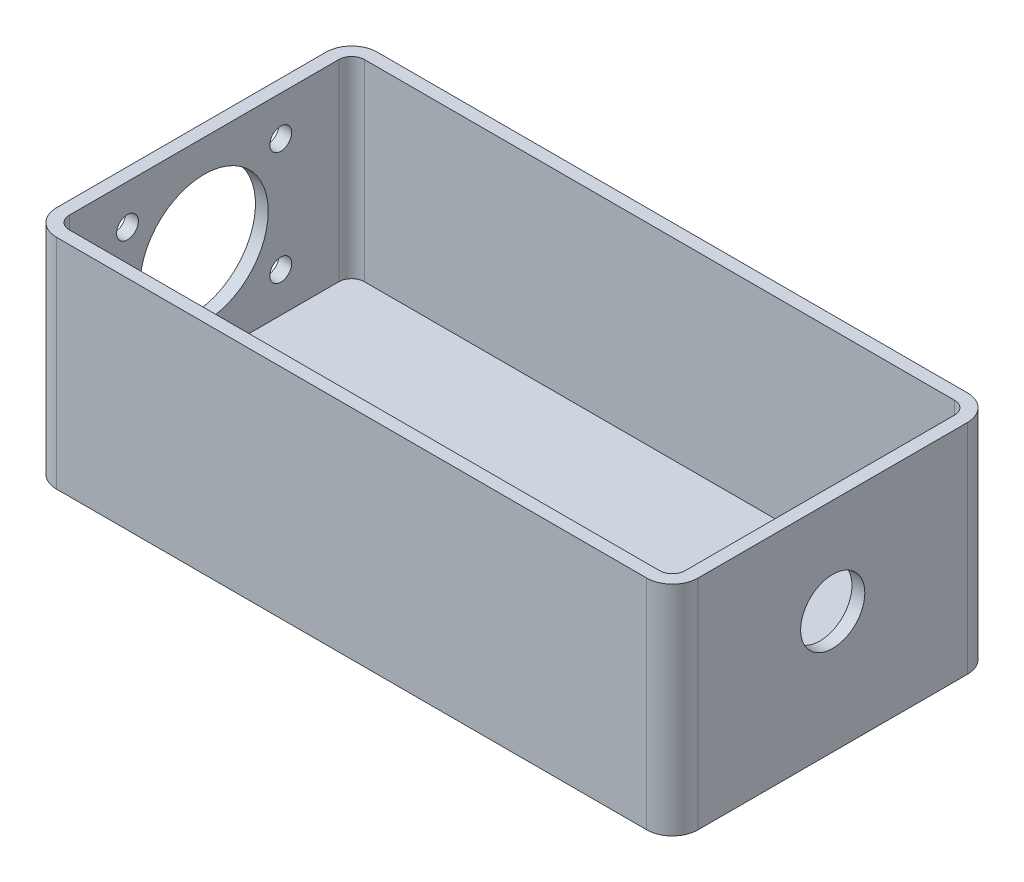
from build123d import *

# Parameters (mm, degrees)
SKETCH1_W           = 127
SKETCH1_H           = 63.5
BOSS_EXTRUDE1_DEPTH = 5.08
SKETCH2_W           = 127
SKETCH2_H           = 63.5
SKETCH2_W_2         = 121.92
SKETCH2_H_2         = 58.42
BOSS_EXTRUDE3_DEPTH = 38.1
CUT_EXTRUDE1_REACH  = 150.411
SKETCH3_R           = 12.7
SKETCH3_R_2         = 2.159
FILLET3_R           = 5.08
FILLET4_R           = 2.54
CUT_EXTRUDE6_REACH  = 150.411
SKETCH4_R           = 6.35


with BuildPart() as part:
    # Sketch1 → Boss-Extrude1 (new body)
    with BuildSketch(Plane(origin=(0, 0, 0), x_dir=(1, 0, 0), z_dir=(0, 1, 0))):
        with Locations((63.5, 31.75)):
            Rectangle(SKETCH1_W, SKETCH1_H)
    extrude(amount=BOSS_EXTRUDE1_DEPTH)

    # Sketch2 → Boss-Extrude3 (add)
    with BuildSketch(Plane(origin=(0, 5.08, 0), x_dir=(1, 0, 0), z_dir=(0, 1, 0))):
        with Locations((63.5, 31.75)):
            Rectangle(SKETCH2_W, SKETCH2_H)
        with Locations((63.5, 31.75)):
            Rectangle(SKETCH2_W_2, SKETCH2_H_2, mode=Mode.SUBTRACT)
    extrude(amount=BOSS_EXTRUDE3_DEPTH)

    # Sketch3 → Cut-Extrude1 (cut, up to next)
    with BuildSketch(Plane.ZY, mode=Mode.PRIVATE) as cut_extrude1_sk1:
        with Locations((-31.75, 24.13)):
            Circle(SKETCH3_R)
    cut_extrude1_tool1 = extrude(cut_extrude1_sk1.sketch, amount=-CUT_EXTRUDE1_REACH, mode=Mode.PRIVATE) & part.part
    # Sketch3 → Cut-Extrude1 (cut, up to next)
    with BuildSketch(Plane.ZY, mode=Mode.PRIVATE) as cut_extrude1_sk2:
        with Locations((-46.9265, 35.3568)):
            Circle(SKETCH3_R_2)
    cut_extrude1_tool2 = extrude(cut_extrude1_sk2.sketch, amount=-CUT_EXTRUDE1_REACH, mode=Mode.PRIVATE) & part.part
    # Sketch3 → Cut-Extrude1 (cut, up to next)
    with BuildSketch(Plane.ZY, mode=Mode.PRIVATE) as cut_extrude1_sk3:
        with Locations((-16.5735, 35.3568)):
            Circle(SKETCH3_R_2)
    cut_extrude1_tool3 = extrude(cut_extrude1_sk3.sketch, amount=-CUT_EXTRUDE1_REACH, mode=Mode.PRIVATE) & part.part
    # Sketch3 → Cut-Extrude1 (cut, up to next)
    with BuildSketch(Plane.ZY, mode=Mode.PRIVATE) as cut_extrude1_sk4:
        with Locations((-46.9265, 12.9032)):
            Circle(SKETCH3_R_2)
    cut_extrude1_tool4 = extrude(cut_extrude1_sk4.sketch, amount=-CUT_EXTRUDE1_REACH, mode=Mode.PRIVATE) & part.part
    # Sketch3 → Cut-Extrude1 (cut, up to next)
    with BuildSketch(Plane.ZY, mode=Mode.PRIVATE) as cut_extrude1_sk5:
        with Locations((-16.5735, 12.9032)):
            Circle(SKETCH3_R_2)
    cut_extrude1_tool5 = extrude(cut_extrude1_sk5.sketch, amount=-CUT_EXTRUDE1_REACH, mode=Mode.PRIVATE) & part.part
    add(cut_extrude1_tool1.solids().sort_by_distance((0, 24.13, -31.75))[0], mode=Mode.SUBTRACT)
    add(cut_extrude1_tool2.solids().sort_by_distance((0, 35.3568, -46.9265))[0], mode=Mode.SUBTRACT)
    add(cut_extrude1_tool3.solids().sort_by_distance((0, 35.3568, -16.5735))[0], mode=Mode.SUBTRACT)
    add(cut_extrude1_tool4.solids().sort_by_distance((0, 12.9032, -46.9265))[0], mode=Mode.SUBTRACT)
    add(cut_extrude1_tool5.solids().sort_by_distance((0, 12.9032, -16.5735))[0], mode=Mode.SUBTRACT)

    # Fillet3
    fillet3_edges = [part.edges().sort_by_distance(p)[0] for p in [
        (0, 21.59, -63.5),
        (127, 21.59, -63.5),
        (127, 21.59, 0),
        (0, 21.59, 0),
    ]]
    fillet(fillet3_edges, radius=FILLET3_R)

    # Fillet4
    fillet4_edges = [part.edges().sort_by_distance(p)[0] for p in [
        (2.54, 24.13, -2.54),
        (124.46, 24.13, -2.54),
        (124.46, 24.13, -60.96),
        (2.54, 24.13, -60.96),
    ]]
    fillet(fillet4_edges, radius=FILLET4_R)

    # Sketch4 → Cut-Extrude6 (cut, up to next)
    with BuildSketch(Plane(origin=(127, 0, 0), x_dir=(0, 0, -1), z_dir=(1, 0, 0)), mode=Mode.PRIVATE) as cut_extrude6_sk1:
        with Locations((31.75, 24.13)):
            Circle(SKETCH4_R)
    cut_extrude6_tool1 = extrude(cut_extrude6_sk1.sketch, amount=-CUT_EXTRUDE6_REACH, mode=Mode.PRIVATE) & part.part
    add(cut_extrude6_tool1.solids().sort_by_distance((127, 24.13, -31.75))[0], mode=Mode.SUBTRACT)


solid = part.part
